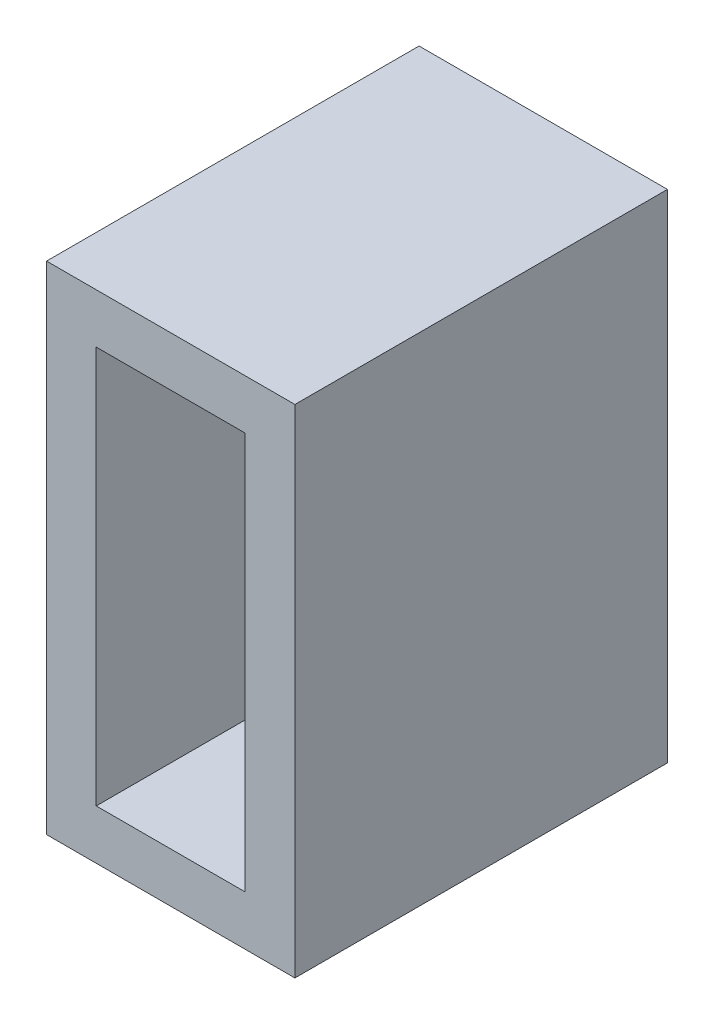
from build123d import *

# Parameters (mm, degrees)
SKETCH1_W           = 25.4
SKETCH1_H           = 50.8
SKETCH1_W_2         = 15.24
SKETCH1_H_2         = 40.64
BOSS_EXTRUDE1_DEPTH = 38.1


with BuildPart() as part:
    # Sketch1 → Boss-Extrude1 (new body)
    with BuildSketch(Plane.XY):
        Rectangle(SKETCH1_W, SKETCH1_H)
        Rectangle(SKETCH1_W_2, SKETCH1_H_2, mode=Mode.SUBTRACT)
    extrude(amount=BOSS_EXTRUDE1_DEPTH)


solid = part.part
